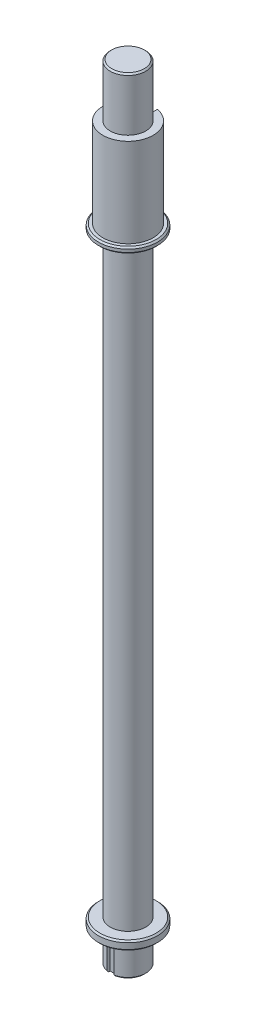
from build123d import *

# Parameters (mm, degrees)
SKETCH3_W           = 2.25
SKETCH3_H           = 2.25
CUT_EXTRUDE1_DEPTH  = 11
CHAMFER1_SIZE       = 0.5
SKETCH4_R           = 8.5
SKETCH4_R_2         = 6
BOSS_EXTRUDE1_DEPTH = 48
SKETCH5_OUTSIDE_W   = 75.302
SKETCH5_OUTSIDE_H   = 75.302
SKETCH5_OUTSIDE_R   = 6
CUT_EXTRUDE2_DEPTH  = 18
SKETCH6_W           = 3.25
SKETCH6_H           = 3.25
CUT_EXTRUDE3_DEPTH  = 30
SKETCH7_R           = 10
SKETCH7_R_2         = 6
BOSS_EXTRUDE2_DEPTH = 2
CHAMFER2_SIZE       = 0.5


with BuildPart() as part:
    # Sketch2 → Revolve1 (revolve)
    with BuildSketch(Plane.XY, mode=Mode.PRIVATE) as revolve1_sk:
        Polygon((0, 0), (6, 0), (6, 11), (10, 11), (10, 14), (6, 14), (6, 265), (0, 265), align=None)
    revolve(revolve1_sk.sketch.rotate(Axis((0, 265, 0), (0, -1, 0)), 180), axis=Axis((0, 265, 0), (0, -1, 0)))

    # Sketch3 → Cut-Extrude1 (cut)
    with BuildSketch(Plane.XZ):
        with Locations((0, 6)):
            Rectangle(SKETCH3_W, SKETCH3_H)
    extrude(amount=-CUT_EXTRUDE1_DEPTH, mode=Mode.SUBTRACT)

    # Chamfer1
    chamfer1_edges = [part.edges().sort_by_distance(p)[0] for p in [
        (0, 0, -6),
        (6, 265, 0),
        (10, 14, 0),
        (10, 11, 0),
    ]]
    chamfer(chamfer1_edges, length=CHAMFER1_SIZE)

    # Sketch4 → Boss-Extrude1 (add)
    with BuildSketch(Plane(origin=(0, 265, 0), x_dir=(1, 0, 0), z_dir=(0, 1, 0))):
        with Locations(Location((0, 0, 0), (0, 0, 180))):
            Circle(SKETCH4_R)
        with Locations(Location((0, 0, 0), (0, 0, 180))):
            Circle(SKETCH4_R_2, mode=Mode.SUBTRACT)
    extrude(amount=-BOSS_EXTRUDE1_DEPTH)

    # Sketch5 outside → Cut-Extrude2 (cut)
    with BuildSketch(Plane(origin=(0, 265, 0), x_dir=(1, 0, 0), z_dir=(0, 1, 0))):
        Rectangle(SKETCH5_OUTSIDE_W, SKETCH5_OUTSIDE_H)
        with Locations(Location((0, 0, 0), (0, 0, 180))):
            Circle(SKETCH5_OUTSIDE_R, mode=Mode.SUBTRACT)
    extrude(amount=-CUT_EXTRUDE2_DEPTH, mode=Mode.SUBTRACT)

    # Sketch6 → Cut-Extrude3 (cut)
    with BuildSketch(Plane(origin=(0, 247, 0), x_dir=(1, 0, 0), z_dir=(0, 1, 0))):
        with Locations((0, 8.5)):
            Rectangle(SKETCH6_W, SKETCH6_H)
    extrude(amount=-CUT_EXTRUDE3_DEPTH, mode=Mode.SUBTRACT)

    # Sketch7 → Boss-Extrude2 (add)
    with BuildSketch(Plane.XZ.offset(-217)):
        with Locations(Location((0, 0, 0), (0, 0, 180))):
            Circle(SKETCH7_R)
        with Locations(Location((0, 0, 0), (0, 0, 180))):
            Circle(SKETCH7_R_2, mode=Mode.SUBTRACT)
    extrude(amount=BOSS_EXTRUDE2_DEPTH)

    # Chamfer2
    chamfer2_edges = [part.edges().sort_by_distance(p)[0] for p in [
        (10, 215, 0),
        (10, 217, 0),
        (6, 215, 0),
    ]]
    chamfer(chamfer2_edges, length=CHAMFER2_SIZE)


solid = part.part
